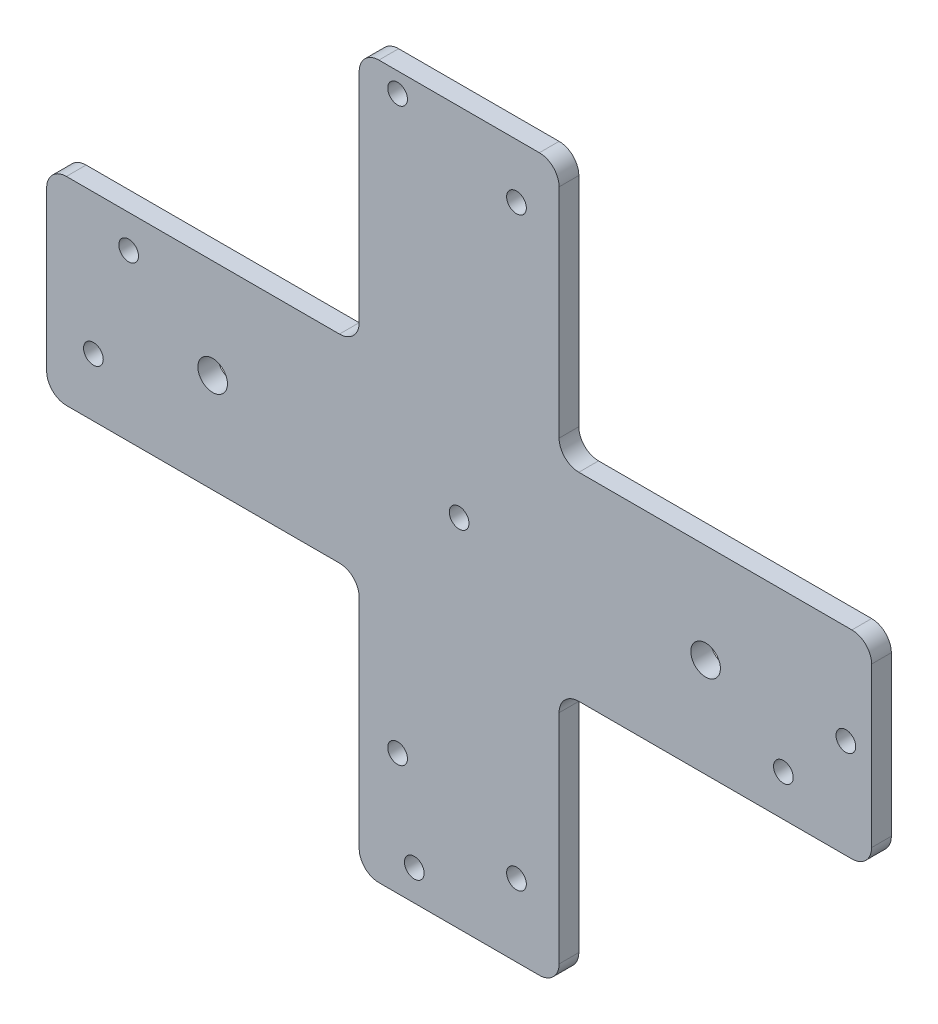
from build123d import *

# Parameters (mm, degrees)
SKETCH_3_R      = 1.5
SKETCH_3_R_2    = 1
EXTRUDE_1_DEPTH = 2


with BuildPart() as part:
    # 草图3 → 凸台-拉伸1 (new body)
    with BuildSketch(Plane.XY):
        with BuildLine():
            Line((118.06282276, 110.61097636), (90.364678066, 110.61097636))
            ThreePointArc((90.364678066, 110.61097636), (88.950464504, 110.025189922), (88.364678066, 108.61097636))
            Line((88.364678066, 108.61097636), (88.364678066, 92.490482591))
            ThreePointArc((88.364678066, 92.490482591), (88.950464504, 91.076269028), (90.364678066, 90.490482591))
            Line((90.364678066, 90.490482591), (118.06282276, 90.490482591))
            ThreePointArc((118.06282276, 90.490482591), (119.477036322, 89.904696153), (120.06282276, 88.490482591))
            Line((120.06282276, 88.490482591), (120.06282276, 66.422251235))
            ThreePointArc((120.06282276, 66.422251235), (120.648609197, 65.008037673), (122.06282276, 64.422251235))
            Line((122.06282276, 64.422251235), (138.340493265, 64.422251235))
            ThreePointArc((138.340493265, 64.422251235), (139.754706828, 65.008037673), (140.340493265, 66.422251235))
            Line((140.340493265, 66.422251235), (140.340493265, 88.490482591))
            ThreePointArc((140.340493265, 88.490482591), (140.926279703, 89.904696153), (142.340493265, 90.490482591))
            Line((142.340493265, 90.490482591), (170.038637959, 90.490482591))
            ThreePointArc((170.038637959, 90.490482591), (171.452851521, 91.076269028), (172.038637959, 92.490482591))
            Line((172.038637959, 92.490482591), (172.038637959, 108.61097636))
            ThreePointArc((172.038637959, 108.61097636), (171.452851521, 110.025189922), (170.038637959, 110.61097636))
            Line((170.038637959, 110.61097636), (142.340493265, 110.61097636))
            ThreePointArc((142.340493265, 110.61097636), (140.926279703, 111.196762797), (140.340493265, 112.61097636))
            Line((140.340493265, 112.61097636), (140.340493265, 134.679207715))
            ThreePointArc((140.340493265, 134.679207715), (139.754706828, 136.093421277), (138.340493265, 136.679207715))
            Line((138.340493265, 136.679207715), (122.06282276, 136.679207715))
            ThreePointArc((122.06282276, 136.679207715), (120.648609197, 136.093421277), (120.06282276, 134.679207715))
            Line((120.06282276, 134.679207715), (120.06282276, 112.61097636))
            ThreePointArc((120.06282276, 112.61097636), (119.477036322, 111.196762797), (118.06282276, 110.61097636))
        make_face()
        with Locations((105.201658013, 100.550729475)):
            Circle(SKETCH_3_R, mode=Mode.SUBTRACT)
        with Locations(Location((155.201658013, 100.550729475, 0), (0, 0, 180))):
            Circle(SKETCH_3_R, mode=Mode.SUBTRACT)
        with Locations((136.017880342, 131.156826246)):
            Circle(SKETCH_3_R_2, mode=Mode.SUBTRACT)
        with Locations((123.959858439, 76.753868602)):
            Circle(SKETCH_3_R_2, mode=Mode.SUBTRACT)
        with Locations((93.105508276, 96.40135135)):
            Circle(SKETCH_3_R_2, mode=Mode.SUBTRACT)
        with Locations((169.425693967, 100.550729475)):
            Circle(SKETCH_3_R_2, mode=Mode.SUBTRACT)
        with Locations((130.201658013, 100.550729475)):
            Circle(SKETCH_3_R_2, mode=Mode.SUBTRACT)
        with Locations((125.650168223, 67.53399009)):
            Circle(SKETCH_3_R_2, mode=Mode.SUBTRACT)
        with Locations((123.959858439, 134.679207715)):
            Circle(SKETCH_3_R_2, mode=Mode.SUBTRACT)
        with Locations((96.683392317, 107.263125424)):
            Circle(SKETCH_3_R_2, mode=Mode.SUBTRACT)
        with Locations((163.089439849, 94.66887503)):
            Circle(SKETCH_3_R_2, mode=Mode.SUBTRACT)
        with Locations((136.017880342, 71.77023795)):
            Circle(SKETCH_3_R_2, mode=Mode.SUBTRACT)
    extrude(amount=EXTRUDE_1_DEPTH)


solid = part.part
